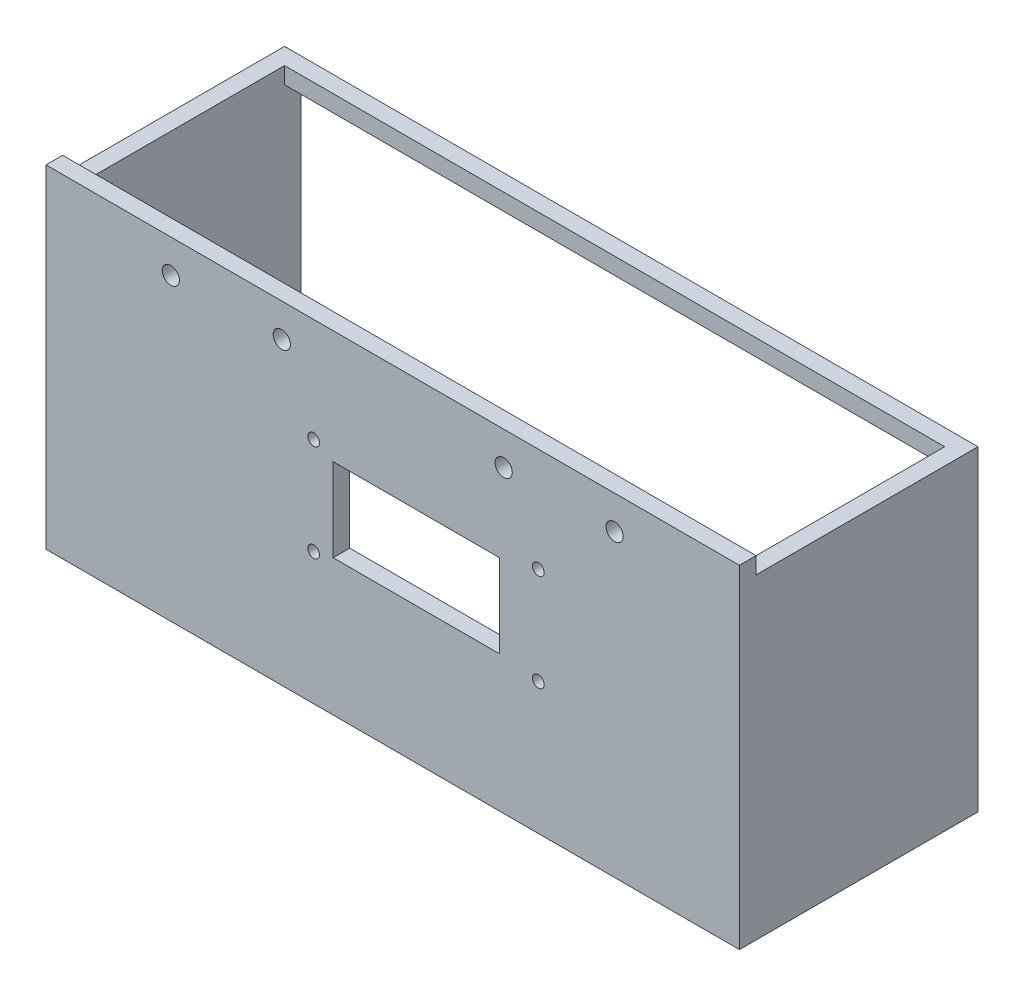
from build123d import *

# Parameters (mm, degrees)
SKETCH_1_W      = 125
SKETCH_1_H      = 60
SKETCH_1_R      = 1.55
SKETCH_1_R_2    = 1.05
SKETCH_1_W_2    = 30
SKETCH_1_H_2    = 15
EXTRUDE_1_DEPTH = 3
SKETCH_4_W      = 3
SKETCH_4_H      = 57
EXTRUDE_3_DEPTH = 43
SKETCH_6_W      = 125
SKETCH_6_H      = 3
EXTRUDE_5_DEPTH = 3


with BuildPart() as part:
    # 草图1 → 凸台-拉伸1 (new body)
    with BuildSketch(Plane.XY):
        Rectangle(SKETCH_1_W, SKETCH_1_H)
        with Locations((-40, 24)):
            Circle(SKETCH_1_R, mode=Mode.SUBTRACT)
        with Locations((-20, 24)):
            Circle(SKETCH_1_R, mode=Mode.SUBTRACT)
        with Locations((20, 24)):
            Circle(SKETCH_1_R, mode=Mode.SUBTRACT)
        with Locations((40, 24)):
            Circle(SKETCH_1_R, mode=Mode.SUBTRACT)
        with Locations((-14.25, 11.25)):
            Circle(SKETCH_1_R_2, mode=Mode.SUBTRACT)
        with Locations((-14.25, -6.25)):
            Circle(SKETCH_1_R_2, mode=Mode.SUBTRACT)
        with Locations((26.25, 11.25)):
            Circle(SKETCH_1_R_2, mode=Mode.SUBTRACT)
        with Locations((26.25, -6.25)):
            Circle(SKETCH_1_R_2, mode=Mode.SUBTRACT)
        with Locations((4.25, 2.05)):
            Rectangle(SKETCH_1_W_2, SKETCH_1_H_2, mode=Mode.SUBTRACT)
    extrude(amount=EXTRUDE_1_DEPTH)

    # 草图4 → 凸台-拉伸3 (add)
    with BuildSketch(Plane.XY.offset(3)):
        with Locations((-61, -1.5)):
            Rectangle(SKETCH_4_W, SKETCH_4_H)
        with Locations((61, -1.5)):
            Rectangle(SKETCH_4_W, SKETCH_4_H)
    extrude(amount=-EXTRUDE_3_DEPTH)

    # 草图6 → 凸台-拉伸5 (add)
    with BuildSketch(Plane(origin=(0, 27, 0), x_dir=(1, 0, 0), z_dir=(0, 1, 0))):
        with Locations((0, 38.5)):
            Rectangle(SKETCH_6_W, SKETCH_6_H)
    extrude(amount=-EXTRUDE_5_DEPTH)


solid = part.part
